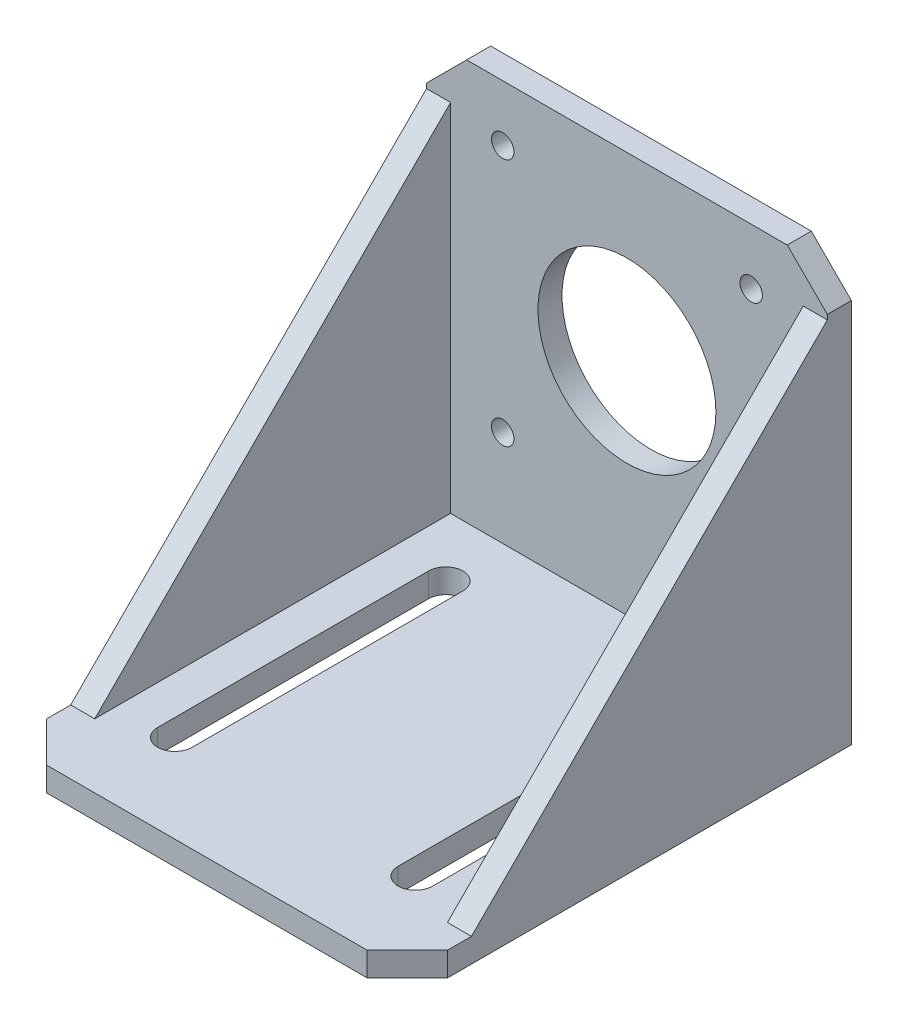
from build123d import *

# Parameters (mm, degrees)
CROQUIS1_R              = 11.1
SALIENTE_EXTRUIR2_DEPTH = 3
CROQUIS2_R              = 1.4
CORTAR_EXTRUIR1_DEPTH   = 40.550600501
CROQUIS3_W              = 50
CROQUIS3_H              = 3
SALIENTE_EXTRUIR3_DEPTH = 52.4
CORTAR_EXTRUIR2_DEPTH   = 81.64217259
SALIENTE_EXTRUIR4_DEPTH = 3


with BuildPart() as part:
    # Croquis1 → Saliente-Extruir2 (new body)
    with BuildSketch(Plane.XY):
        Polygon((20, 22.5), (-20, 22.5), (-25, 17.5), (-25, -30.5), (25, -30.5), (25, 17.5), align=None)
        Circle(CROQUIS1_R, mode=Mode.SUBTRACT)
    extrude(amount=SALIENTE_EXTRUIR2_DEPTH)

    # Croquis2 → Cortar-Extruir1 (cut, through all)
    with BuildSketch(Plane.XY.offset(3)):
        with Locations((-15.5, 15.5)):
            Circle(CROQUIS2_R)
        with Locations((15.5, 15.5)):
            Circle(CROQUIS2_R)
        with Locations((15.5, -15.5)):
            Circle(CROQUIS2_R)
        with Locations((-15.5, -15.5)):
            Circle(CROQUIS2_R)
    extrude(amount=-CORTAR_EXTRUIR1_DEPTH, mode=Mode.SUBTRACT)

    # Croquis3 → Saliente-Extruir3 (add)
    with BuildSketch(Plane.XY.offset(3)):
        with Locations((0, -29)):
            Rectangle(CROQUIS3_W, CROQUIS3_H)
    extrude(amount=SALIENTE_EXTRUIR3_DEPTH)

    # Croquis4 → Cortar-Extruir2 (cut, through all)
    with BuildSketch(Plane.XZ.offset(30.5)):
        Polygon((-25, 50.4), (-20, 55.4), (-25, 55.4), align=None)
        with BuildLine():
            Line((-17.15, 44.4), (-17.15, 10.6))
            ThreePointArc((-17.15, 10.6), (-15, 8.45), (-12.85, 10.6))
            Line((-12.85, 10.6), (-12.85, 44.4))
            ThreePointArc((-12.85, 44.4), (-15, 46.55), (-17.15, 44.4))
        make_face()
        with BuildLine():
            Line((12.85, 44.4), (12.85, 10.6))
            ThreePointArc((12.85, 10.6), (15, 8.45), (17.15, 10.6))
            Line((17.15, 10.6), (17.15, 44.4))
            ThreePointArc((17.15, 44.4), (15, 46.55), (12.85, 44.4))
        make_face()
        Polygon((25, 55.4), (25, 50.4), (20, 55.4), align=None)
    extrude(amount=-CORTAR_EXTRUIR2_DEPTH, mode=Mode.SUBTRACT)

    # Croquis5 → Saliente-Extruir4 (add)
    with BuildSketch(Plane.ZY.offset(25)):
        Polygon((3, 16.9), (3, -27.5), (47.4, -27.5), align=None)
    saliente_extruir4 = extrude(amount=-SALIENTE_EXTRUIR4_DEPTH)

    # Simetría1: Saliente-Extruir4 across plane
    add(saliente_extruir4.mirror(Plane(origin=(0, 0, 0), x_dir=(0, 0, 1), z_dir=(1, 0, 0))))


solid = part.part
